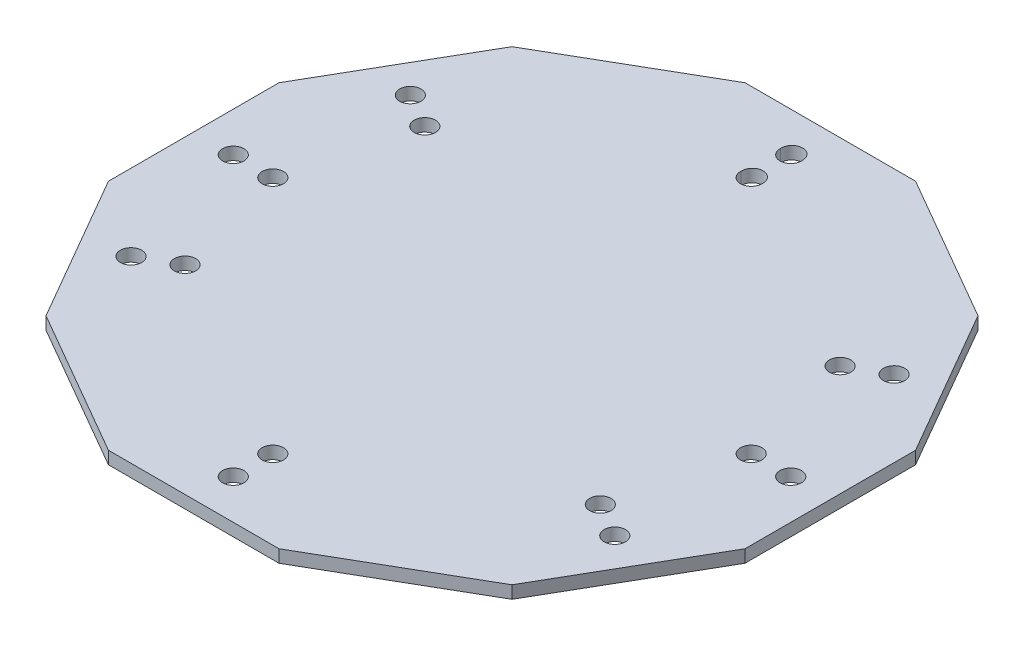
from build123d import *

# Parameters (mm, degrees)
BOSS_EXTRUDE1_DEPTH = 4.78
SKETCH3_R           = 4.05
CUT_EXTRUDE1_DEPTH  = 4.78
CIRPATTERN1_COUNT   = 6
CIRPATTERN3_COUNT   = 4


with BuildPart() as part:
    # Sketch2 → Boss-Extrude1 (new body)
    with BuildSketch(Plane(origin=(0, 0, 0), x_dir=(1, 0, 0), z_dir=(0, 1, 0))):
        Polygon((120.740728286, 32.352380638), (88.388347648, 88.388347648), (32.352380638, 120.740728286), (-32.352380638, 120.740728286), (-88.388347648, 88.388347648), (-120.740728286, 32.352380638), (-120.740728286, -32.352380638), (-88.388347648, -88.388347648), (-32.352380638, -120.740728286), (32.352380638, -120.740728286), (88.388347648, -88.388347648), (120.740728286, -32.352380638), align=None)
    extrude(amount=BOSS_EXTRUDE1_DEPTH)

    # Sketch3 → Cut-Extrude1 (cut)
    with BuildSketch(Plane(origin=(0, 4.78, 0), x_dir=(1, 0, 0), z_dir=(0, 1, 0))):
        with Locations(Location((-0.002380638, -105.740728286, 0), (0, 0, 270))):
            Circle(SKETCH3_R)
        with Locations(Location((-0.002380638, -90.740728286, 0), (0, 0, 270))):
            Circle(SKETCH3_R)
    cut_extrude1 = extrude(amount=-CUT_EXTRUDE1_DEPTH, mode=Mode.SUBTRACT)

    # CirPattern1: Cut-Extrude1 ×6 about axis
    cirpattern1_axis = Axis((5.246e-06, 0, -0.216469196), (0, 1, 0))
    for i in range(1, CIRPATTERN1_COUNT):
        add(cut_extrude1.rotate(cirpattern1_axis, i * 360 / CIRPATTERN1_COUNT), mode=Mode.SUBTRACT)

    # CirPattern3: Cut-Extrude1 ×4 about axis
    cirpattern3_axis = Axis((-7e-08, 0, 0.002893764), (0, 1, 0))
    for i in range(1, CIRPATTERN3_COUNT):
        add(cut_extrude1.rotate(cirpattern3_axis, i * 360 / CIRPATTERN3_COUNT), mode=Mode.SUBTRACT)


solid = part.part
